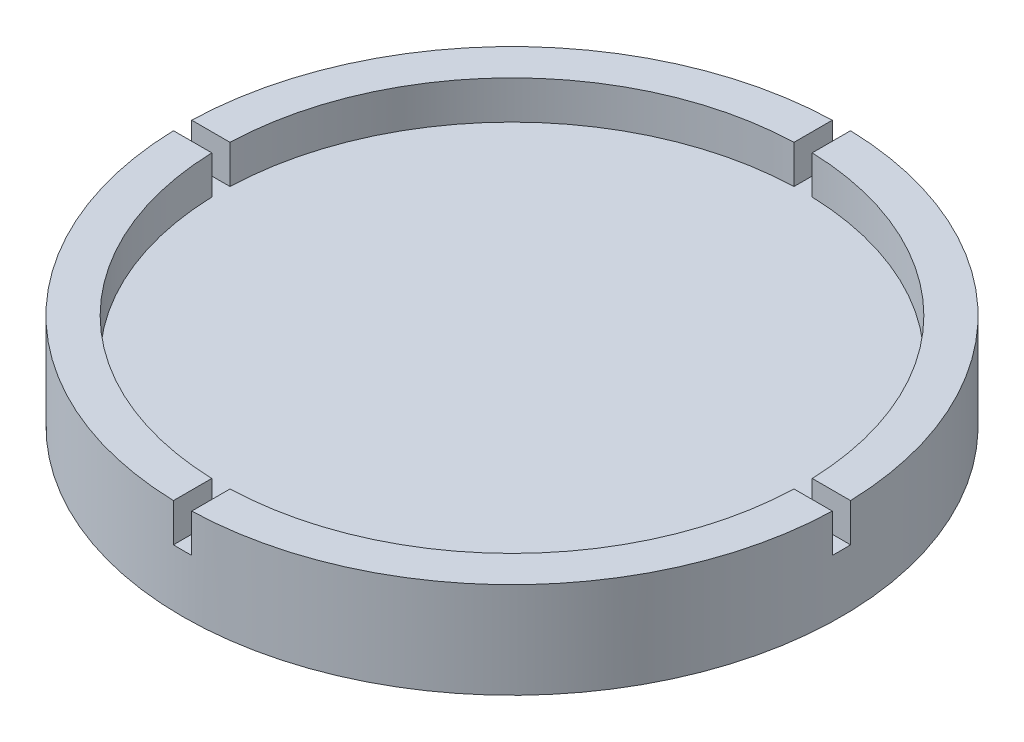
from build123d import *

# Parameters (mm, degrees)
SKETCH2_R           = 76
BOSS_EXTRUDE1_DEPTH = 15
SKETCH4_R           = 86
SKETCH4_R_2         = 76
BOSS_EXTRUDE2_DEPTH = 25
CUT_EXTRUDE1_DEPTH  = 10


with BuildPart() as part:
    # Sketch2 → Boss-Extrude1 (new body)
    with BuildSketch(Plane(origin=(0, 0, 0), x_dir=(1, 0, 0), z_dir=(0, 1, 0))):
        with Locations(Location((0, 0, 0), (0, 0, 270))):
            Circle(SKETCH2_R)
    extrude(amount=BOSS_EXTRUDE1_DEPTH)

    # Sketch4 → Boss-Extrude2 (add)
    with BuildSketch(Plane(origin=(0, 0, 0), x_dir=(-1, 0, 0), z_dir=(0, -1, 0))):
        with Locations(Location((0, 0, 0), (0, 0, 90))):
            Circle(SKETCH4_R)
        with Locations(Location((0, 0, 0), (0, 0, 90))):
            Circle(SKETCH4_R_2, mode=Mode.SUBTRACT)
    extrude(amount=-BOSS_EXTRUDE2_DEPTH)

    # Sketch5 → Cut-Extrude1 (cut)
    with BuildSketch(Plane(origin=(0, 25, 0), x_dir=(1, 0, 0), z_dir=(0, 1, 0))):
        Polygon((86, 0), (86, 2.38), (75.161889678, 2.38), (75.161889678, -2.38), (86.243553227, -2.38), align=None)
        Polygon((-86, 0), (-86, 2.38), (-75.22208349, 2.38), (-75.22208349, -2.38), (-86.457059311, -2.38), align=None)
        Polygon((0, 86), (2.38, 86), (2.38, 74.13986027), (-2.38, 74.13986027), (-2.38, 86.447056085), align=None)
        Polygon((0, -86), (2.38, -86), (2.38, -74.817551039), (-2.38, -74.817551039), (-2.38, -87.761718776), align=None)
    extrude(amount=-CUT_EXTRUDE1_DEPTH, mode=Mode.SUBTRACT)


solid = part.part
